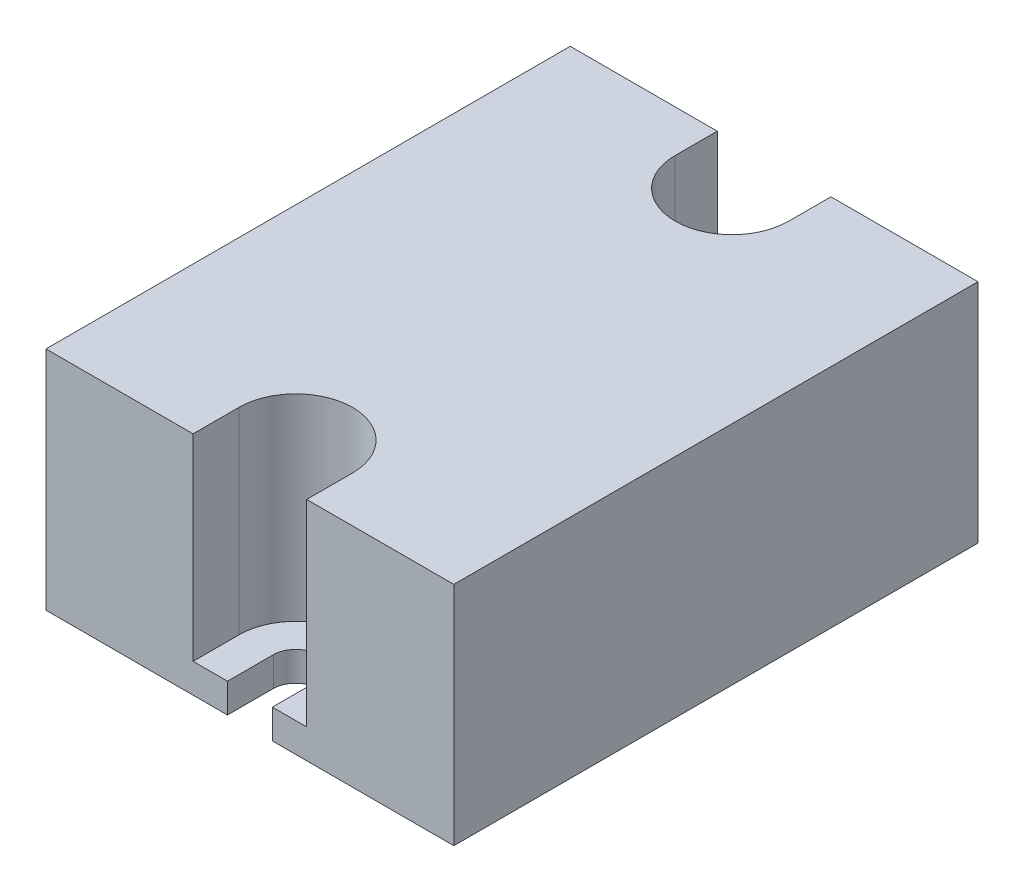
from build123d import *

# Parameters (mm, degrees)
SKETCH1_R           = 2.45
BOSS_EXTRUDE1_DEPTH = 3.2
BOSS_EXTRUDE2_DEPTH = 21.5


with BuildPart() as part:
    # Sketch1 → Boss-Extrude1 (new body)
    with BuildSketch(Plane(origin=(0, 0, 0), x_dir=(1, 0, 0), z_dir=(0, 1, 0))):
        with BuildLine():
            Line((0, 0), (19.8, 0))
            Line((19.8, 0), (19.8, 5))
            ThreePointArc((19.8, 5), (22.25, 7.45), (24.7, 5))
            Line((24.7, 5), (24.7, 0))
            Line((24.7, 0), (44.5, 0))
            Line((44.5, 0), (44.5, 57.2))
            Line((44.5, 57.2), (28.45, 57.2))
            Line((28.45, 57.2), (16.05, 57.2))
            Line((16.05, 57.2), (0, 57.2))
            Line((0, 57.2), (0, 0))
        make_face()
        with Locations(Location((22.25, 52.6, 0), (0, 0, 270))):
            Circle(SKETCH1_R, mode=Mode.SUBTRACT)
    extrude(amount=BOSS_EXTRUDE1_DEPTH)

    # Sketch2 → Boss-Extrude2 (add)
    with BuildSketch(Plane(origin=(0, 3.2, 0), x_dir=(1, 0, 0), z_dir=(0, 1, 0))):
        with BuildLine():
            Line((0, 0), (0, 57.2))
            Line((0, 57.2), (16.05, 57.2))
            Line((16.05, 57.2), (16.05, 52.6))
            ThreePointArc((16.05, 52.6), (22.25, 46.4), (28.45, 52.6))
            Line((28.45, 52.6), (28.45, 57.2))
            Line((28.45, 57.2), (44.5, 57.2))
            Line((44.5, 57.2), (44.5, 0))
            Line((44.5, 0), (28.45, 0))
            Line((28.45, 0), (28.45, 5))
            ThreePointArc((28.45, 5), (22.25, 11.2), (16.05, 5))
            Line((16.05, 5), (16.05, 0))
            Line((16.05, 0), (0, 0))
        make_face()
    extrude(amount=BOSS_EXTRUDE2_DEPTH)


solid = part.part
